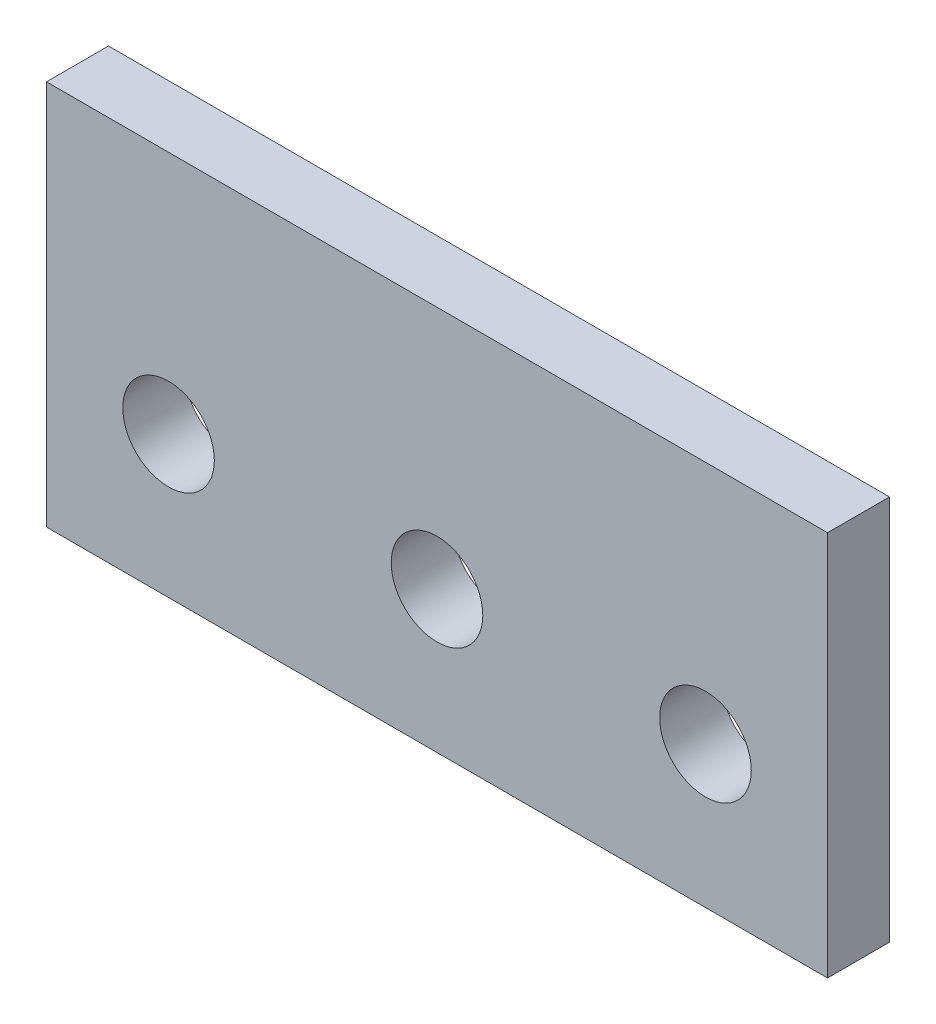
from build123d import *

# Parameters (mm, degrees)
CROQUIS1_W              = 320
CROQUIS1_H              = 158
CROQUIS1_R              = 18.764717073
SALIENTE_EXTRUIR1_DEPTH = 25.4


with BuildPart() as part:
    # Croquis1 → Saliente-Extruir1 (new body)
    with BuildSketch(Plane.XY):
        with Locations((0, 21)):
            Rectangle(CROQUIS1_W, CROQUIS1_H)
        Circle(CROQUIS1_R, mode=Mode.SUBTRACT)
        with Locations((110, 0)):
            Circle(CROQUIS1_R, mode=Mode.SUBTRACT)
        with Locations((-110, 0)):
            Circle(CROQUIS1_R, mode=Mode.SUBTRACT)
    extrude(amount=SALIENTE_EXTRUIR1_DEPTH)


solid = part.part
